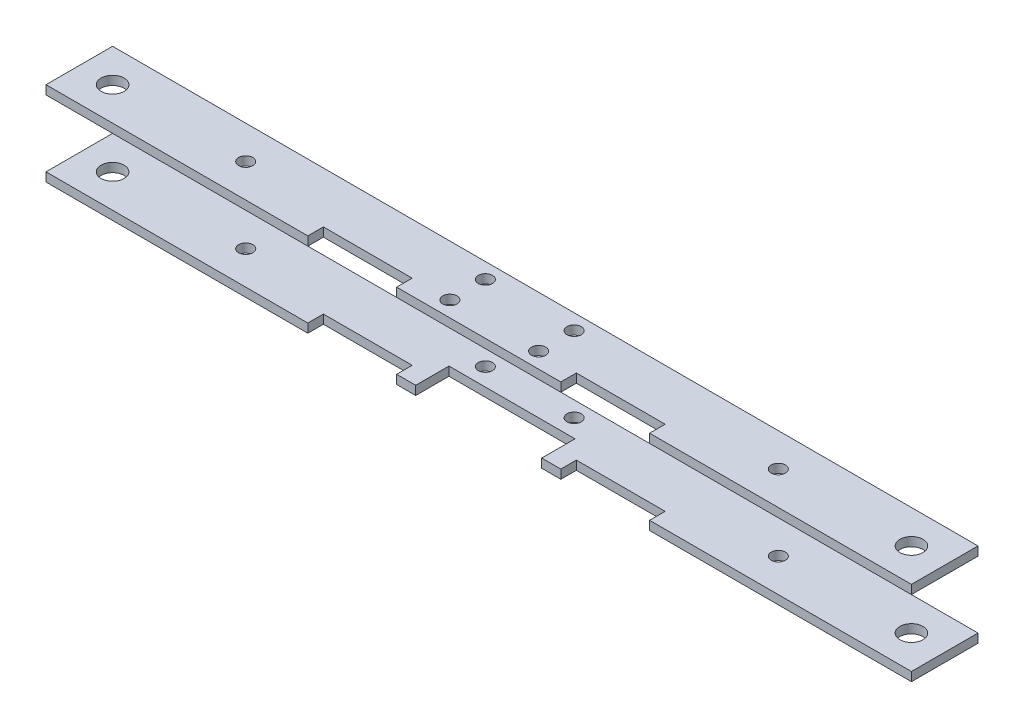
from build123d import *

# Parameters (mm, degrees)
SKETCH_1_R          = 1.6
SKETCH_1_R_2        = 2.6
EXTRUDE_1_DEPTH     = 2
SKETCH_2_W          = 28.4
SKETCH_2_H          = 7.5
CUT_EXTRUDE_1_DEPTH = 100.25472281


with BuildPart() as part:
    # 草图1 → 凸台-拉伸1 (new body)
    with BuildSketch(Plane(origin=(0, 7.5, 0), x_dir=(1, 0, 0), z_dir=(0, 1, 0))):
        Polygon((97.5, 7.5), (-97.5, 7.5), (-97.5, -7.5), (-38.5, -7.5), (-38.5, -4), (-18.5, -4), (-18.5, -7.5), (18.5, -7.5), (18.5, -4), (38.5, -4), (38.5, -7.5), (97.5, -7.5), align=None)
        with Locations(Location((-10, -4, 0), (0, 0, 270))):
            Circle(SKETCH_1_R, mode=Mode.SUBTRACT)
        with Locations(Location((-90, 0, 0), (0, 0, 270))):
            Circle(SKETCH_1_R_2, mode=Mode.SUBTRACT)
        with Locations(Location((-60, 0, 0), (0, 0, 270))):
            Circle(SKETCH_1_R, mode=Mode.SUBTRACT)
        with Locations(Location((10, -4, 0), (0, 0, 270))):
            Circle(SKETCH_1_R, mode=Mode.SUBTRACT)
        with Locations(Location((-10, 4, 0), (0, 0, 270))):
            Circle(SKETCH_1_R, mode=Mode.SUBTRACT)
        with Locations(Location((60, 0, 0), (0, 0, 270))):
            Circle(SKETCH_1_R, mode=Mode.SUBTRACT)
        with Locations(Location((90, 0, 0), (0, 0, 270))):
            Circle(SKETCH_1_R_2, mode=Mode.SUBTRACT)
        with Locations(Location((10, 4, 0), (0, 0, 270))):
            Circle(SKETCH_1_R, mode=Mode.SUBTRACT)
    extrude(amount=EXTRUDE_1_DEPTH)


with BuildPart() as body_2:
    # 镜向3: mirrored copy
    add(part.part.mirror(Plane.ZX))

    # 草图2 → 切除-拉伸1 (cut, through all)
    with BuildSketch(Plane(origin=(0, -7.5, 0), x_dir=(1, 0, 0), z_dir=(0, 1, 0))):
        with Locations((0, -3.75)):
            Rectangle(SKETCH_2_W, SKETCH_2_H)
    extrude(amount=-CUT_EXTRUDE_1_DEPTH, mode=Mode.SUBTRACT)


solid = Compound([part.part, body_2.part])
